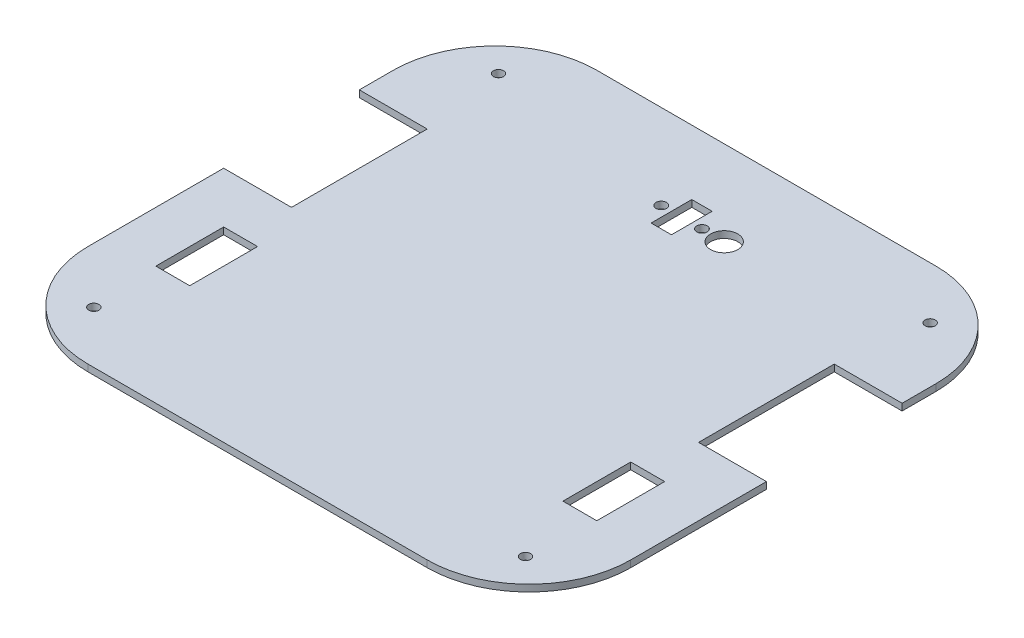
from build123d import *

# Parameters (mm, degrees)
SKETCH1_R           = 1.5
BOSS_EXTRUDE1_DEPTH = 2
SKETCH2_R           = 1.55
SKETCH2_R_2         = 4
SKETCH2_W           = 6
SKETCH2_H           = 12
CUT_EXTRUDE1_DEPTH  = 10
SKETCH3_W           = 10
SKETCH3_H           = 20
CUT_EXTRUDE2_DEPTH  = 10


with BuildPart() as part:
    # Sketch1 → Boss-Extrude1 (new body)
    with BuildSketch(Plane(origin=(0, 0, 0), x_dir=(1, 0, 0), z_dir=(0, 1, 0))):
        with BuildLine():
            Line((-80, 35), (-60, 35))
            Line((-60, 35), (-60, -5))
            Line((-60, -5), (-80, -5))
            Line((-80, -5), (-80, -45))
            ThreePointArc((-80, -45), (-71.213203436, -66.213203436), (-50, -75))
            Line((-50, -75), (50, -75))
            ThreePointArc((50, -75), (71.213203436, -66.213203436), (80, -45))
            Line((80, -45), (80, -5))
            Line((80, -5), (60, -5))
            Line((60, -5), (60, 35))
            Line((60, 35), (80, 35))
            Line((80, 35), (80, 45))
            ThreePointArc((80, 45), (71.213203436, 66.213203436), (50, 75))
            Line((50, 75), (-50, 75))
            ThreePointArc((-50, 75), (-71.213203436, 66.213203436), (-80, 45))
            Line((-80, 45), (-80, 35))
        make_face()
        with Locations(Location((-63.621027185, 59.644712986, 0), (0, 0, 270))):
            Circle(SKETCH1_R, mode=Mode.SUBTRACT)
        with Locations(Location((63.621027185, 59.644712986, 0), (0, 0, 90))):
            Circle(SKETCH1_R, mode=Mode.SUBTRACT)
        with Locations(Location((63.621027185, -59.644712986, 0), (0, 0, 270))):
            Circle(SKETCH1_R, mode=Mode.SUBTRACT)
        with Locations(Location((-63.621027185, -59.644712986, 0), (0, 0, 90))):
            Circle(SKETCH1_R, mode=Mode.SUBTRACT)
    extrude(amount=BOSS_EXTRUDE1_DEPTH)

    # Sketch2 → Cut-Extrude1 (cut)
    with BuildSketch(Plane(origin=(0, 2, 0), x_dir=(1, 0, 0), z_dir=(0, 1, 0))):
        with Locations(Location((-6, 50, 0), (0, 0, 270))):
            Circle(SKETCH2_R)
        with Locations(Location((6, 50, 0), (0, 0, 270))):
            Circle(SKETCH2_R)
        with Locations(Location((12.55, 50, 0), (0, 0, 270))):
            Circle(SKETCH2_R_2)
        with Locations((0, 50)):
            Rectangle(SKETCH2_W, SKETCH2_H)
    extrude(amount=-CUT_EXTRUDE1_DEPTH, mode=Mode.SUBTRACT)

    # Sketch3 → Cut-Extrude2 (cut)
    with BuildSketch(Plane(origin=(0, 2, 0), x_dir=(1, 0, 0), z_dir=(0, 1, 0))):
        with Locations((-60, -30)):
            Rectangle(SKETCH3_W, SKETCH3_H)
        with Locations((60, -30)):
            Rectangle(SKETCH3_W, SKETCH3_H)
    extrude(amount=-CUT_EXTRUDE2_DEPTH, mode=Mode.SUBTRACT)


solid = part.part
